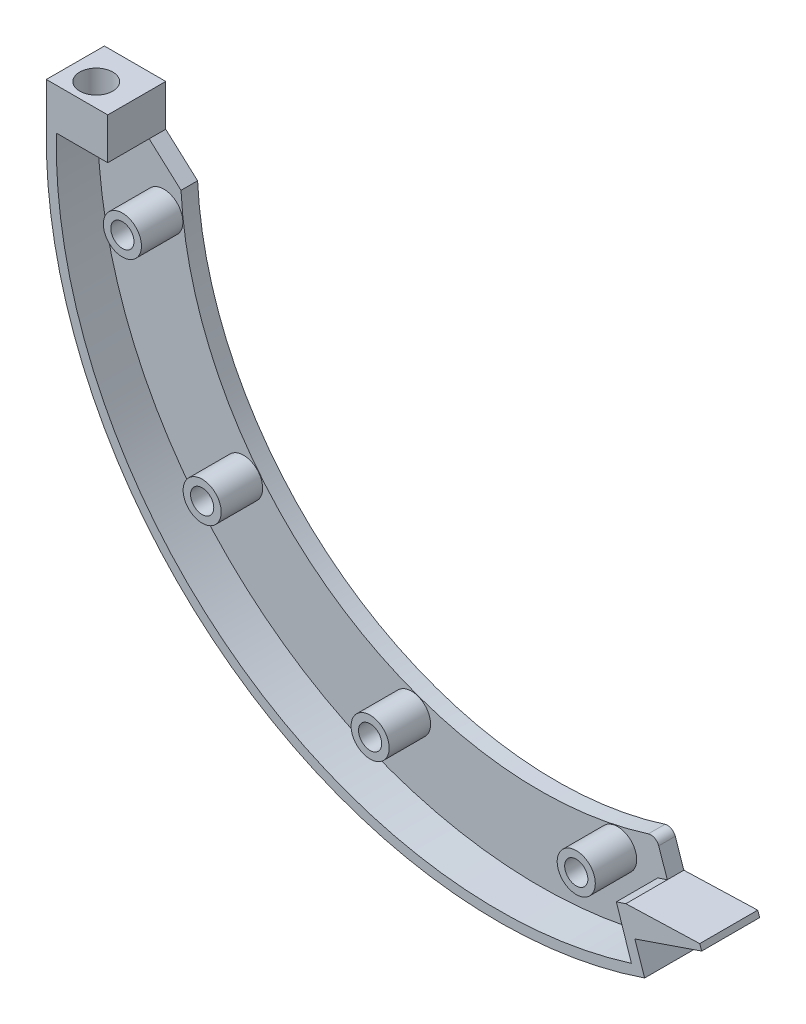
from build123d import *

# Parameters (mm, degrees)
BOSS_EXTRUDE1_DEPTH = 2
BOSS_EXTRUDE2_DEPTH = 5
SKETCH3_R           = 2.3
BOSS_EXTRUDE3_DEPTH = 5
BOSS_EXTRUDE4_DEPTH = 5
SKETCH6_R           = 1.4
CUT_EXTRUDE1_DEPTH  = 5
SKETCH7_R           = 2
CUT_EXTRUDE2_DEPTH  = 8


with BuildPart() as part:
    # Sketch1 → Boss-Extrude1 (new body)
    with BuildSketch(Plane.XY):
        with BuildLine():
            Line((16.887910555, -133.369322594), (14.673679255, -134.127250965))
            Line((14.673679255, -134.127250965), (15.867669408, -137.615404294))
            ThreePointArc((15.867669408, -137.615404294), (-34.007319131, -130.034150274), (-56.342527733, -84.8))
            Line((-56.342527733, -84.8), (-48.940455795, -84.8))
            Line((-48.940455795, -84.8), (-45.096768624, -88.26027792))
            ThreePointArc((-45.096768624, -88.26027792), (-26.483938318, -121.642871269), (11.312186404, -127.325119655))
            ThreePointArc((11.312186404, -127.325119655), (12.064722619, -127.385308804), (12.560733381, -127.954436921))
            Line((12.560733381, -127.954436921), (13.597675192, -130.983785211))
            Line((13.597675192, -130.983785211), (22.508911342, -130.69915726))
            Line((22.508911342, -130.69915726), (22.749464344, -131.362920683))
            Line((22.749464344, -131.362920683), (16.887910555, -133.369322594))
        make_face()
    extrude(amount=BOSS_EXTRUDE1_DEPTH)

    # Sketch2 → Boss-Extrude2 (add)
    with BuildSketch(Plane.XY.offset(2)):
        with BuildLine():
            Line((-56.342527733, -84.8), (-55.142230801, -84.8))
            ThreePointArc((-55.142230801, -84.8), (-55.152352766, -85.399962054), (-55.155726896, -86))
            ThreePointArc((-55.155726896, -86), (-33.342347458, -129.033761126), (14.261826326, -136.880464731))
            Line((14.261826326, -136.880464731), (12.45002618, -131.36047245))
            Line((12.45002618, -131.36047245), (13.597675192, -130.983785211))
            Line((13.597675192, -130.983785211), (15.867669408, -137.615404294))
            ThreePointArc((15.867669408, -137.615404294), (15.540815193, -137.726132378), (15.21326709, -137.834790682))
            ThreePointArc((15.21326709, -137.834790682), (-33.801189066, -130.184178235), (-56.355726896, -86))
            ThreePointArc((-56.355726896, -86), (-56.352427006, -85.399963706), (-56.342527733, -84.8))
        make_face()
    extrude(amount=BOSS_EXTRUDE2_DEPTH)

    # Sketch3 → Boss-Extrude3 (add)
    with BuildSketch(Plane.XY.offset(2)):
        with Locations((7.607262335, -130.722795016)):
            Circle(SKETCH3_R)
        with Locations((-17.271773957, -129.003020951)):
            Circle(SKETCH3_R)
        with Locations((-37.543895432, -114.478381178)):
            Circle(SKETCH3_R)
        with Locations((-47.172740285, -91.473829097)):
            Circle(SKETCH3_R)
        Polygon((14.673679255, -134.127250965), (22.749464344, -131.362920683), (22.508911342, -130.69915726), (13.597675192, -130.983785211), align=None)
    extrude(amount=BOSS_EXTRUDE3_DEPTH)

    # Sketch4 → Boss-Extrude4 (add)
    with BuildSketch(Plane(origin=(0, -84.8, 0), x_dir=(1, 0, 0), z_dir=(0, 1, 0))):
        Polygon((-56.342527733, 0), (-48.940455795, 0), (-48.940455795, -7), (-56.355726896, -7), align=None)
    extrude(amount=BOSS_EXTRUDE4_DEPTH)

    # Sketch6 → Cut-Extrude1 (cut)
    with BuildSketch(Plane.XY.offset(7)):
        with Locations((-47.172740285, -91.473829097)):
            Circle(SKETCH6_R)
        with Locations((-37.543895432, -114.478381178)):
            Circle(SKETCH6_R)
        with Locations((-17.271773957, -129.003020951)):
            Circle(SKETCH6_R)
        with Locations((7.607262335, -130.722795016)):
            Circle(SKETCH6_R)
    extrude(amount=-CUT_EXTRUDE1_DEPTH, mode=Mode.SUBTRACT)

    # Sketch7 → Cut-Extrude2 (cut)
    with BuildSketch(Plane(origin=(0, -79.8, 0), x_dir=(1, 0, 0), z_dir=(0, 1, 0))):
        with Locations(Location((-53.113278602, -4.212750817, 0), (0, 0, 270))):
            Circle(SKETCH7_R)
    extrude(amount=-CUT_EXTRUDE2_DEPTH, mode=Mode.SUBTRACT)


solid = part.part
